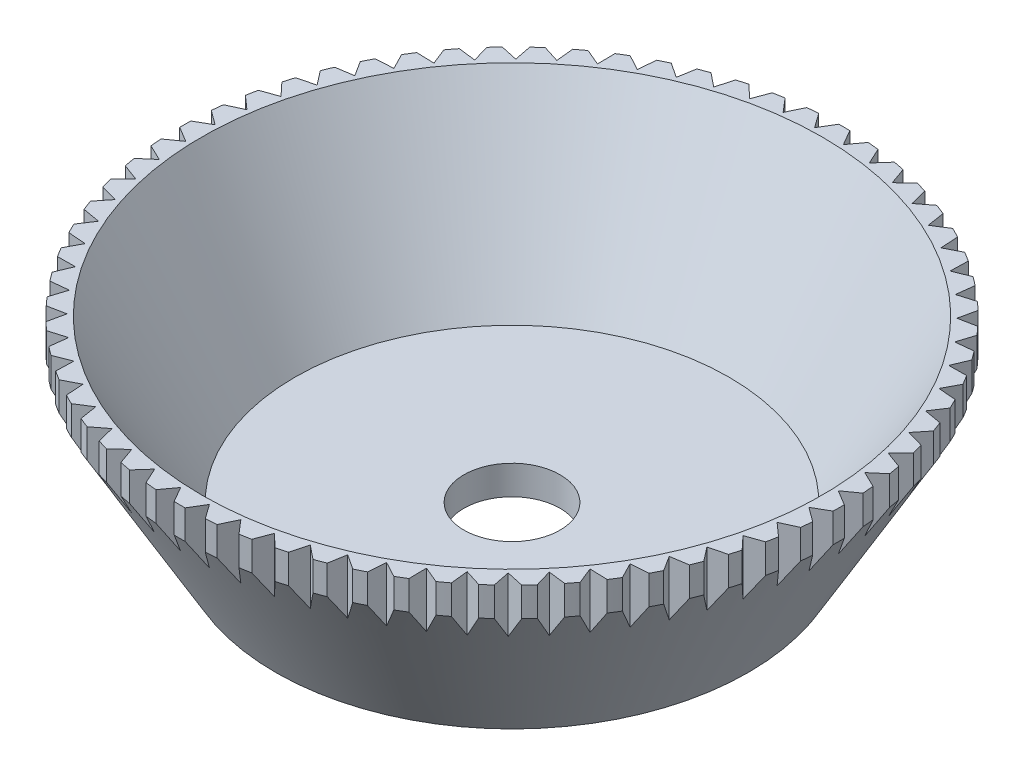
from build123d import *

# Parameters (mm, degrees)
CUT_EXTRUDE1_DEPTH = 10
CIRPATTERN1_COUNT  = 68


with BuildPart() as part:
    # Sketch1 → Revolve1 (revolve)
    with BuildSketch(Plane.XY, mode=Mode.PRIVATE) as revolve1_sk:
        Polygon((12.19349084, 5.174881928), (17, 13.5), (17, 15), (16, 15), (11.19349084, 6.674881928), (2.477514433, 6.674881928), (2.477514433, 5.174881928), align=None)
    revolve(revolve1_sk.sketch.rotate(Axis((0, 5.174881928, 0), (0, 1, 0)), 90), axis=Axis((0, 5.174881928, 0), (0, 1, 0)))

    # Sketch2 → Cut-Extrude1 (cut)
    with BuildSketch(Plane(origin=(0, 15, 0), x_dir=(1, 0, 0), z_dir=(0, 1, 0))):
        with BuildLine():
            Line((0.13958081, -16.999426967), (0.610803508, -16.216569347))
            Line((0.610803508, -16.216569347), (1.13958081, -16.961761571))
            ThreePointArc((1.13958081, -16.961761571), (0.639858018, -16.987954018), (0.13958081, -16.999426967))
        make_face()
    cut_extrude1 = extrude(amount=-CUT_EXTRUDE1_DEPTH, mode=Mode.SUBTRACT)

    # CirPattern1: Cut-Extrude1 ×68 about axis
    cirpattern1_axis = Axis((0, 0, 0), (0, 1, 0))
    for i in range(1, CIRPATTERN1_COUNT):
        add(cut_extrude1.rotate(cirpattern1_axis, i * 360 / CIRPATTERN1_COUNT), mode=Mode.SUBTRACT)


solid = part.part
